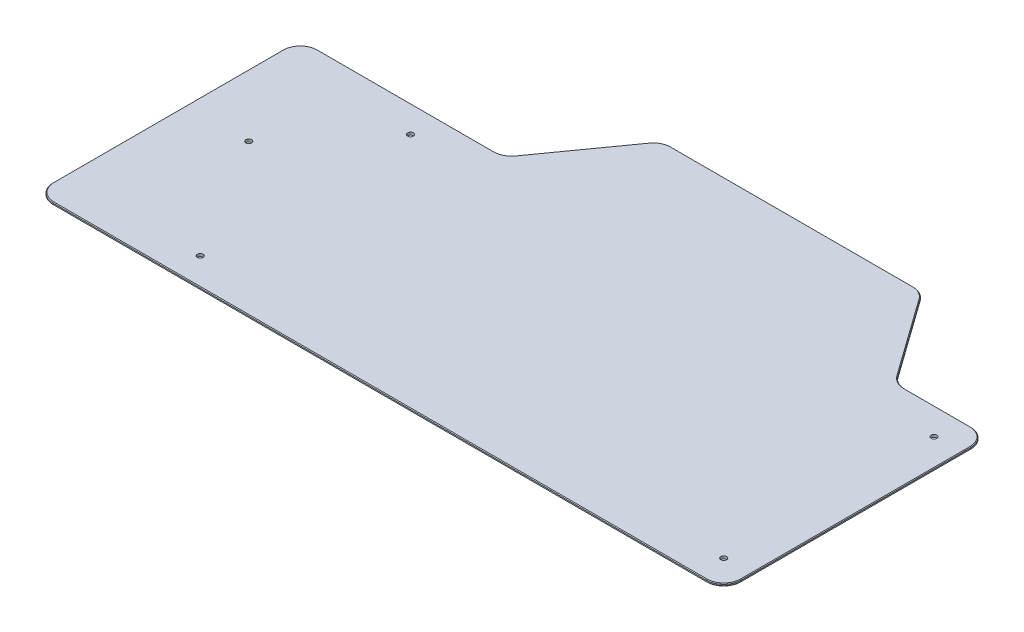
from build123d import *

# Parameters (mm, degrees)
SKETCH_1_W          = 780
SKETCH_1_H          = 300
EXTRUDE_1_DEPTH     = 3
FILLET_3_R          = 20
CHAMFER_1_SIZE      = 0.8
SKETCH_2_R          = 3.25
CUT_EXTRUDE_1_DEPTH = 10


with BuildPart() as part:
    # 草图1 → 凸台-拉伸1 (new body)
    with BuildSketch(Plane(origin=(0, 0, 0), x_dir=(1, 0, 0), z_dir=(0, 1, 0))):
        with Locations((390, 150)):
            Rectangle(SKETCH_1_W, SKETCH_1_H)
        Polygon((600, 405), (305, 405), (230, 300), (305, 300), (600, 300), (675, 300), align=None)
    extrude(amount=EXTRUDE_1_DEPTH)

    # 圆角3
    fillet_3_edges = [part.edges().sort_by_distance(p)[0] for p in [
        (0, 1.5, 0),
        (0, 1.5, -300),
        (230, 1.5, -300),
        (305, 1.5, -405),
        (600, 1.5, -405),
        (675, 1.5, -300),
        (780, 1.5, -300),
        (780, 1.5, 0),
    ]]
    fillet(fillet_3_edges, radius=FILLET_3_R)

    # 倒角1
    chamfer_1_edges = [part.edges().sort_by_distance(p)[0] for p in [
        (390, 0, 0),
        (390, 3, 0),
        (0, 0, -150),
        (119.853821047, 0, -300),
        (267.5, 0, -352.5),
        (452.5, 0, -405),
        (637.5, 0, -352.5),
        (722.646178953, 0, -300),
        (780, 0, -150),
        (5.857864376, 0, -294.142135624),
        (774.142135624, 0, -5.857864376),
        (774.142135624, 0, -294.142135624),
        (598.859273711, 0, -402.783352854),
        (306.140726289, 0, -402.783352854),
        (5.857864376, 0, -5.857864376),
        (0, 3, -150),
        (780, 3, -150),
        (722.646178953, 3, -300),
        (637.5, 3, -352.5),
        (452.5, 3, -405),
        (267.5, 3, -352.5),
        (119.853821047, 3, -300),
        (5.857864376, 3, -294.142135624),
        (774.142135624, 3, -5.857864376),
        (774.142135624, 3, -294.142135624),
        (598.859273711, 3, -402.783352854),
        (306.140726289, 3, -402.783352854),
        (5.857864376, 3, -5.857864376),
        (228.859273711, 0, -302.216647146),
        (228.859273711, 3, -302.216647146),
        (676.140726289, 0, -302.216647146),
        (676.140726289, 3, -302.216647146),
    ]]
    chamfer(chamfer_1_edges, length=CHAMFER_1_SIZE)

    # 草图2 → 切除-拉伸1 (cut)
    with BuildSketch(Plane(origin=(0, 3, 0), x_dir=(1, 0, 0), z_dir=(0, 1, 0))):
        with Locations(Location((70.8, 170.8, 0), (0, 0, 270))):
            Circle(SKETCH_2_R)
        with Locations(Location((749.2, 269.2, 0), (0, 0, 270))):
            Circle(SKETCH_2_R)
        with Locations(Location((749.2, 30.8, 0), (0, 0, 270))):
            Circle(SKETCH_2_R)
        with Locations(Location((155.8, 30.8, 0), (0, 0, 270))):
            Circle(SKETCH_2_R)
        with Locations(Location((155.8, 269.2, 0), (0, 0, 270))):
            Circle(SKETCH_2_R)
    extrude(amount=-CUT_EXTRUDE_1_DEPTH, mode=Mode.SUBTRACT)


solid = part.part
